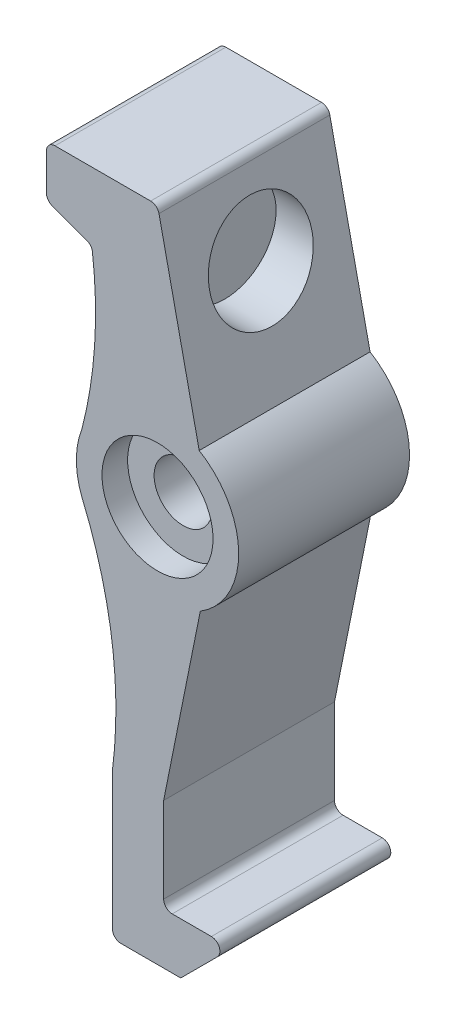
from build123d import *

# Parameters (mm, degrees)
SKETCH_1_R          = 3.25
SKETCH_1_R_2        = 1.7
EXTRUDE_1_DEPTH     = 5
CUT_EXTRUDE_START   = 5
SKETCH_1_4_R        = 3.25
CUT_EXTRUDE_1_DEPTH = 1.5
CUT_EXTRUDE_START_2 = -5
SKETCH_1_5_R        = 3.25
CUT_EXTRUDE_2_DEPTH = 1.5
CUT_EXTRUDE_START_3 = 2.43999
SKETCH_2_R          = 3
CUT_EXTRUDE_3_DEPTH = 3.5


with BuildPart() as part:
    # Эскиз1 → Бобышка-Вытянуть1 (new, symmetric)
    # profile 1 of 4: a face of its own
    with BuildSketch(Plane.XY):
        with BuildLine():
            Line((-0.402987496, 15.3), (-6, 15.3))
            ThreePointArc((-6, 15.3), (-6.353553391, 15.153553391), (-6.5, 14.8))
            Line((-6.5, 14.8), (-6.5, 12.650103769))
            ThreePointArc((-6.5, 12.650103769), (-6.409576022, 12.363315551), (-6.171010072, 12.180257459))
            Line((-6.171010072, 12.180257459), (-4.136019248, 11.439581372))
            ThreePointArc((-4.136019248, 11.439581372), (-3.91562246, 11.280863122), (-3.810716101, 11.0303419))
            ThreePointArc((-3.810716101, 11.0303419), (-3.681235408, 6.344733002), (-4.428694025, 1.717314542))
            ThreePointArc((-4.428694025, 1.717314542), (-1.542362614, 4.492618119), (2.439992619, 4.07540624))
            Line((2.439992619, 4.07540624), (0.085601919, 14.90620915))
            ThreePointArc((0.085601919, 14.90620915), (-0.089223711, 15.189297171), (-0.402987496, 15.3))
        make_face()
    # profile 2 of 4: a face of its own
    with BuildSketch(Plane.XY):
        with BuildLine():
            ThreePointArc((4.75, 0), (4.13233983, 2.342278278), (2.439992619, 4.07540624))
            ThreePointArc((2.439992619, 4.07540624), (-1.542362614, 4.492618119), (-4.428694025, 1.717314542))
            ThreePointArc((-4.428694025, 1.717314542), (-4.75, 0), (-4.428694025, -1.717314542))
            ThreePointArc((-4.428694025, -1.717314542), (-4.378812236, -1.835465051), (-4.329537208, -1.953869895))
            ThreePointArc((-4.329537208, -1.953869895), (-1.385071911, -4.543575222), (2.503326388, -4.036812727))
            ThreePointArc((2.503326388, -4.036812727), (4.150499991, -2.309945849), (4.75, 0))
        make_face()
        Circle(SKETCH_1_R, mode=Mode.SUBTRACT)
    # profile 3 of 4: a face of its own
    with BuildSketch(Plane.XY):
        Circle(SKETCH_1_R)
        Circle(SKETCH_1_R_2, mode=Mode.SUBTRACT)
    # profile 4 of 4: a face of its own
    with BuildSketch(Plane.XY):
        with BuildLine():
            Line((0.359159672, -14.7), (2.503326388, -4.036812727))
            ThreePointArc((2.503326388, -4.036812727), (-1.385071911, -4.543575222), (-4.329537208, -1.953869895))
            ThreePointArc((-4.329537208, -1.953869895), (-2.65175784, -8.216516162), (-2.640840328, -14.7))
            Line((-2.640840328, -14.7), (-2.640840328, -22.7))
            ThreePointArc((-2.640840328, -22.7), (-2.494393719, -23.053553391), (-2.140840328, -23.2))
            Line((-2.140840328, -23.2), (1.359159672, -23.2))
            Line((1.359159672, -23.2), (3.505606281, -21.053553391))
            ThreePointArc((3.505606281, -21.053553391), (3.613992657, -20.508658284), (3.152052891, -20.2))
            Line((3.152052891, -20.2), (0.859159672, -20.2))
            ThreePointArc((0.859159672, -20.2), (0.505606281, -20.053553391), (0.359159672, -19.7))
            Line((0.359159672, -19.7), (0.359159672, -14.7))
        make_face()
    extrude(amount=EXTRUDE_1_DEPTH, both=True)

    # Эскиз1<4> → Вырез-Вытянуть1 (cut)
    with BuildSketch(Plane.XY.offset(CUT_EXTRUDE_START)):
        Circle(SKETCH_1_4_R)
    extrude(amount=-CUT_EXTRUDE_1_DEPTH, mode=Mode.SUBTRACT)

    # Эскиз1<5> → Вырез-Вытянуть2 (cut)
    with BuildSketch(Plane.XY.offset(CUT_EXTRUDE_START_2)):
        Circle(SKETCH_1_5_R)
    extrude(amount=CUT_EXTRUDE_2_DEPTH, mode=Mode.SUBTRACT)

    # Эскиз2 → Вырез-Вытянуть3 (cut)
    with BuildSketch(Plane(origin=(0, 0.681903291, 0), x_dir=(0, 0, -1), z_dir=(1, 0, 0)).offset(CUT_EXTRUDE_START_3)):
        with Locations((0, 9.818096709)):
            Circle(SKETCH_2_R)
    extrude(amount=-CUT_EXTRUDE_3_DEPTH, mode=Mode.SUBTRACT)


solid = part.part
